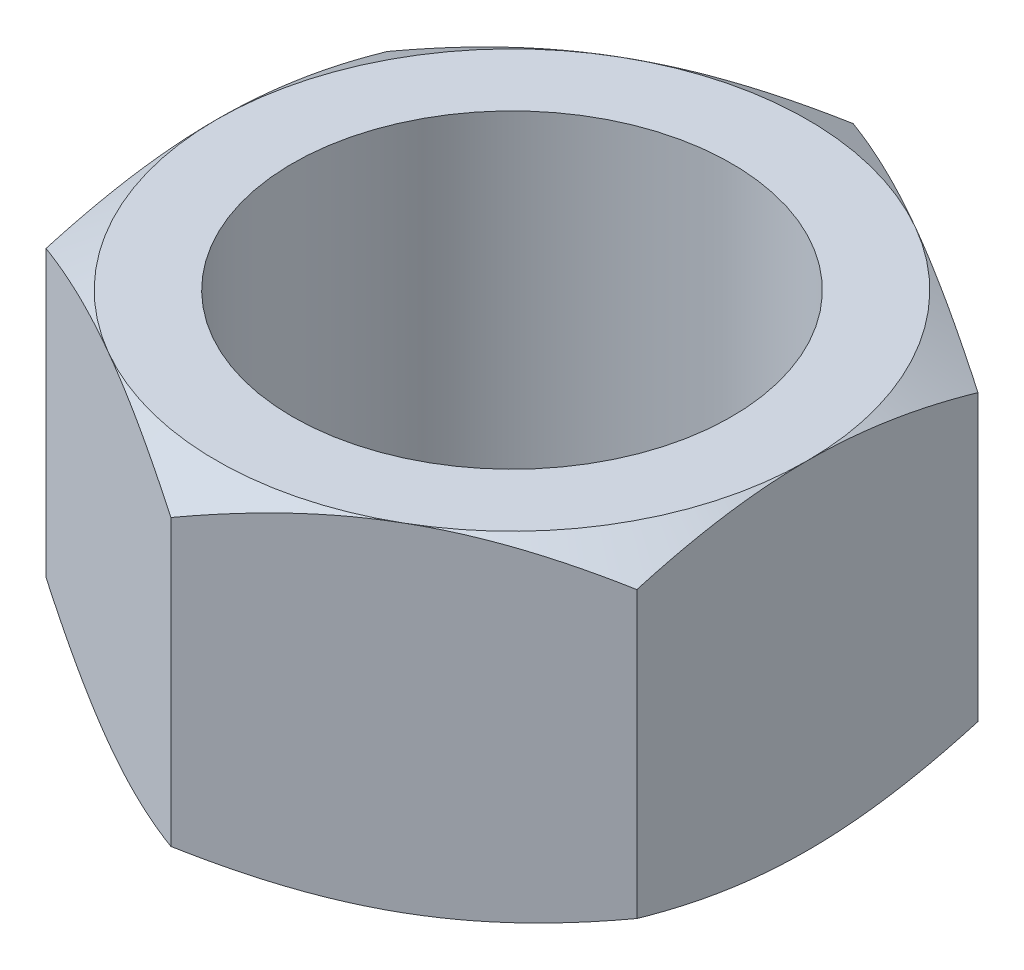
from build123d import *

# Parameters (mm, degrees)
SKETCH1_R           = 3.302
BOSS_EXTRUDE1_DEPTH = 2.54
SKETCH2_OUTSIDE_W   = 31.388
SKETCH2_OUTSIDE_H   = 32.764
SKETCH2_OUTSIDE_R   = 4.445
CUT_EXTRUDE1_DEPTH  = 5.08
CUT_EXTRUDE1_DRAFT  = -60
SKETCH3_OUTSIDE_W   = 31.388
SKETCH3_OUTSIDE_H   = 32.764
SKETCH3_OUTSIDE_R   = 4.445
CUT_EXTRUDE2_DEPTH  = 5.08
CUT_EXTRUDE2_DRAFT  = -60


with BuildPart() as part:
    # Sketch1 → Boss-Extrude1 (new, symmetric)
    with BuildSketch(Plane(origin=(0, 0, 0), x_dir=(1, 0, 0), z_dir=(0, 1, 0))):
        Polygon((0, 5.132643893), (-4.445, 2.566321947), (-4.445, -2.566321947), (0, -5.132643893), (4.445, -2.566321947), (4.445, 2.566321947), align=None)
        with Locations(Location((0, 0, 0), (0, 0, 270))):
            Circle(SKETCH1_R, mode=Mode.SUBTRACT)
    extrude(amount=BOSS_EXTRUDE1_DEPTH, both=True)


with BuildPart() as cut_extrude1_tool:
    # Sketch2 outside → Cut-Extrude1 (with draft: the straight prism first)
    with BuildSketch(Plane(origin=(0, 2.54, 0), x_dir=(1, 0, 0), z_dir=(0, 1, 0))):
        Rectangle(SKETCH2_OUTSIDE_W, SKETCH2_OUTSIDE_H)
        Circle(SKETCH2_OUTSIDE_R, mode=Mode.SUBTRACT)
    extrude(amount=-CUT_EXTRUDE1_DEPTH)
    # Cut-Extrude1: the draft: its side faces are tilted about the plane it starts from
    cut_extrude1_sides = [cut_extrude1_tool.faces().sort_by_distance(p)[0] for p in [
        (0, 0, 16.382),
        (15.694, 0, 0),
        (0, 0, -16.382),
        (-15.694, 0, 0),
        (-4.445, 0, 0),
    ]]
    draft(cut_extrude1_sides, Plane(origin=(0, 2.54, 0), x_dir=(1, 0, 0), z_dir=(0, 1, 0)), CUT_EXTRUDE1_DRAFT)


with BuildPart() as part_1:
    add(part.part)

    # Cut-Extrude1: cut by cut_extrude1_tool
    add(cut_extrude1_tool.part, mode=Mode.SUBTRACT)


with BuildPart() as cut_extrude2_tool:
    # Sketch3 outside → Cut-Extrude2 (with draft: the straight prism first)
    with BuildSketch(Plane(origin=(0, -2.54, 0), x_dir=(-1, 0, 0), z_dir=(0, -1, 0))):
        Rectangle(SKETCH3_OUTSIDE_W, SKETCH3_OUTSIDE_H)
        Circle(SKETCH3_OUTSIDE_R, mode=Mode.SUBTRACT)
    extrude(amount=-CUT_EXTRUDE2_DEPTH)
    # Cut-Extrude2: the draft: its side faces are tilted about the plane it starts from
    cut_extrude2_sides = [cut_extrude2_tool.faces().sort_by_distance(p)[0] for p in [
        (0, 0, 16.382),
        (-15.694, 0, 0),
        (0, 0, -16.382),
        (15.694, 0, 0),
        (4.445, 0, 0),
    ]]
    draft(cut_extrude2_sides, Plane(origin=(0, -2.54, 0), x_dir=(-1, 0, 0), z_dir=(0, -1, 0)), CUT_EXTRUDE2_DRAFT)


with BuildPart() as part_2:
    add(part_1.part)

    # Cut-Extrude2: cut by cut_extrude2_tool
    add(cut_extrude2_tool.part, mode=Mode.SUBTRACT)


solid = part_2.part
